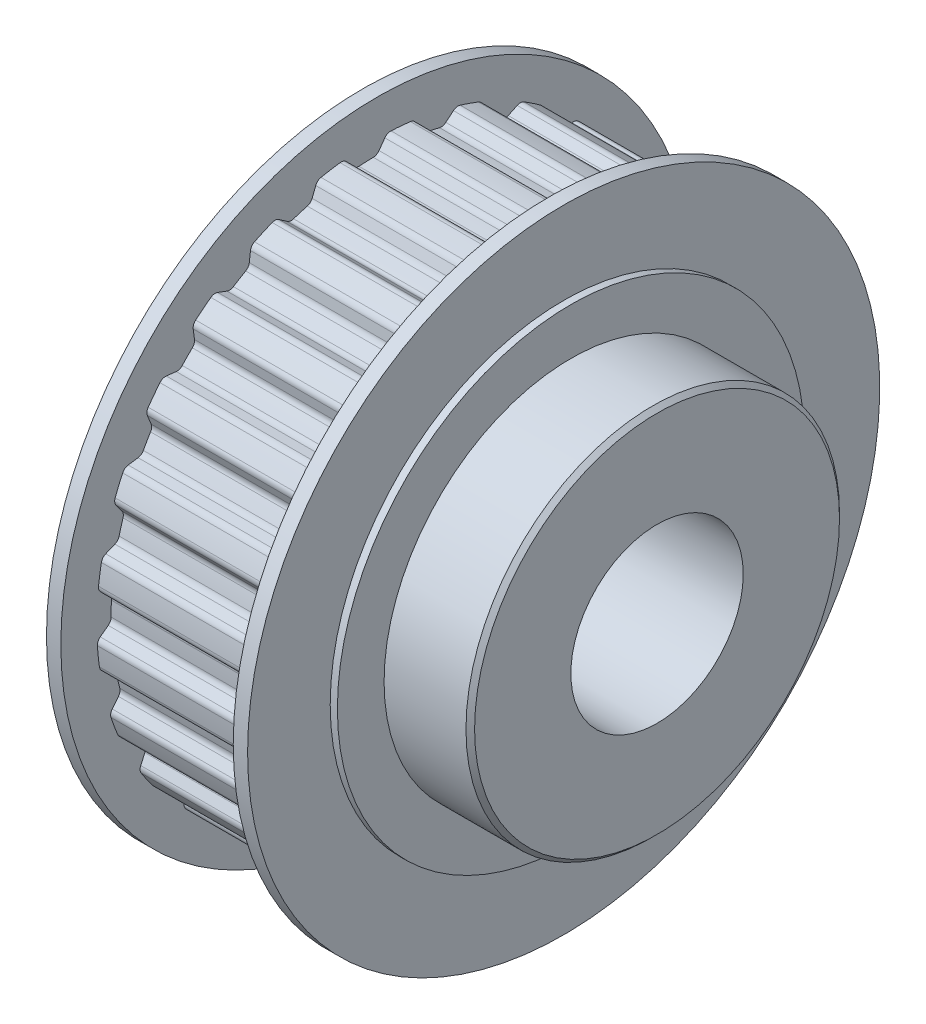
from build123d import *

# Parameters (mm, degrees)
CUT_EXTRUDE1_START = -12
CUT_EXTRUDE1_DEPTH = 12
FILLET1_R          = 0.5
SKETCH3_R          = 6
CUT_EXTRUDE2_DEPTH = 38.536648758
CHAMFER1_SIZE      = 0.3


with BuildPart() as part:
    # Sketch1 → Revolve1 (revolve)
    with BuildSketch(Plane.XY, mode=Mode.PRIVATE) as revolve1_sk:
        Polygon((0, 0), (0, 16.25), (0.5, 16.25), (0.5, 22), (1.5, 22), (1.5, 19.5), (13.5, 19.5), (13.5, 22), (14.5, 22), (14.5, 16.25), (15, 16.25), (15, 13), (21, 13), (21, 0), align=None)
    revolve(revolve1_sk.sketch.rotate(Axis((0, 0, 0), (1, 0, 0)), 90), axis=Axis((0, 0, 0), (1, 0, 0)))

    # Sketch2 → Cut-Extrude1 (cut)
    with BuildSketch(Plane.ZY.offset(-1.5).offset(CUT_EXTRUDE1_START)):
        with BuildLine():
            Line((2.288843908, 19.365205746), (1.5, 18.439088915))
            ThreePointArc((1.5, 18.439088915), (0.750618105, 18.484765956), (0, 18.5))
            Line((0, 18.5), (-0.711156092, 19.487027916))
            ThreePointArc((-0.711156092, 19.487027916), (0.791192057, 19.483942494), (2.288843908, 19.365205746))
        make_face()
        with BuildLine():
            Line((4.600762913, 17.918788481), (4.157412958, 19.051664429))
            ThreePointArc((4.157412958, 19.051664429), (5.611794764, 18.675057149), (7.032866499, 18.187599864))
            Line((7.032866499, 18.187599864), (6.038489683, 17.486756198))
            ThreePointArc((6.038489683, 17.486756198), (5.324010417, 17.717361911), (4.600762913, 17.918788481))
        make_face()
        with BuildLine():
            Line((8.912442971, 16.211673581), (8.764756462, 17.419214798))
            ThreePointArc((8.764756462, 17.419214798), (10.079787767, 16.692749281), (11.334988224, 15.867200193))
            Line((11.334988224, 15.867200193), (10.197558852, 15.435666279))
            ThreePointArc((10.197558852, 15.435666279), (9.562875574, 15.836710856), (8.912442971, 16.211673581))
        make_face()
        with BuildLine():
            Line((12.66412146, 13.485919607), (12.821378083, 14.692251838))
            ThreePointArc((12.821378083, 14.692251838), (13.914430635, 13.661574584), (14.924890951, 12.549805979))
            Line((14.924890951, 12.549805979), (13.715877894, 12.414696678))
            ThreePointArc((13.715877894, 12.414696678), (13.200870089, 12.960981016), (12.66412146, 13.485919607))
        make_face()
        with BuildLine():
            Line((15.620066622, 9.912795707), (16.072385365, 11.04212066))
            ThreePointArc((16.072385365, 11.04212066), (16.874778651, 9.771992912), (17.577007889, 8.4438613))
            Line((17.577007889, 8.4438613), (16.372377884, 8.613666027))
            ThreePointArc((16.372377884, 8.613666027), (16.009405387, 9.270865071), (15.620066622, 9.912795707))
        make_face()
        with BuildLine():
            Line((17.594545551, 5.716814396), (18.313505565, 6.698172432))
            ThreePointArc((18.313505565, 6.698172432), (18.774822264, 5.268400987), (19.124696779, 3.807357762))
            Line((19.124696779, 3.807357762), (18.000141158, 4.271407061))
            ThreePointArc((18.000141158, 4.271407061), (17.812010866, 4.998226577), (17.594545551, 5.716814396))
        make_face()
        with BuildLine():
            Line((18.463494476, 1.161624611), (19.403920858, 1.933353395))
            ThreePointArc((19.403920858, 1.933353395), (19.495174745, 0.433776052), (19.470710634, -1.068376068))
            Line((19.470710634, -1.068376068), (18.496889364, -0.33924012))
            ThreePointArc((18.496889364, -0.33924012), (18.495422194, 0.411531126), (18.463494476, 1.161624611))
        make_face()
        with BuildLine():
            Line((18.172314138, -3.46655432), (19.27511644, -2.952945346))
            ThreePointArc((19.27511644, -2.952945346), (18.990573699, -4.428104628), (18.593308131, -5.876979899))
            Line((18.593308131, -5.876979899), (17.831409984, -4.928571597))
            ThreePointArc((17.831409984, -4.928571597), (18.016698124, -4.20102234), (18.172314138, -3.46655432))
        make_face()
        with BuildLine():
            Line((16.739300471, -7.876916894), (17.935185568, -7.65369967))
            ThreePointArc((17.935185568, -7.65369967), (17.292725064, -9.011751209), (16.547619698, -10.31631147))
            Line((16.547619698, -10.31631147), (16.045517535, -9.208222794))
            ThreePointArc((16.045517535, -9.208222794), (16.405918651, -8.549610121), (16.739300471, -7.876916894))
        make_face()
        with BuildLine():
            Line((14.254494991, -11.79234381), (15.468321026, -11.873543896))
            ThreePointArc((15.468321026, -11.873543896), (14.508310916, -13.029156318), (13.46218346, -14.10743125))
            Line((13.46218346, -14.10743125), (13.251426209, -12.909287487))
            ThreePointArc((13.251426209, -12.909287487), (13.764294971, -12.360994456), (14.254494991, -11.79234381))
        make_face()
        with BuildLine():
            Line((10.874027167, -14.966814396), (12.029524985, -15.347329691))
            ThreePointArc((12.029524985, -15.347329691), (10.812286235, -16.227891618), (9.530868726, -17.012129241))
            Line((9.530868726, -17.012129241), (9.624699038, -15.799214171))
            ThreePointArc((9.624699038, -15.799214171), (10.257810018, -15.395692048), (10.874027167, -14.966814396))
        make_face()
        with BuildLine():
            Line((6.810304225, -17.200864989), (7.834869647, -17.856786318))
            ThreePointArc((7.834869647, -17.856786318), (6.436885845, -18.406968806), (5.000694457, -18.847892586))
            Line((5.000694457, -18.847892586), (5.39321663, -17.696418123))
            ThreePointArc((5.39321663, -17.696418123), (6.106789135, -17.463021688), (6.810304225, -17.200864989))
        make_face()
        with BuildLine():
            Line((2.318664821, -18.354121974), (3.147920635, -19.244235388))
            ThreePointArc((3.147920635, -19.244235388), (1.657032244, -19.429468447), (0.156308165, -19.499373522))
            Line((0.156308165, -19.499373522), (0.822858586, -18.481691041))
            ThreePointArc((0.822858586, -18.481691041), (1.572056232, -18.43308545), (2.318664821, -18.354121974))
        make_face()
        with BuildLine():
            Line((-2.318664821, -18.354121974), (-1.736823807, -19.422498373))
            ThreePointArc((-1.736823807, -19.422498373), (-3.226938787, -19.231143129), (-4.697899545, -18.925637106))
            Line((-4.697899545, -18.925637106), (-3.79920269, -18.105691341))
            ThreePointArc((-3.79920269, -18.105691341), (-3.061454746, -18.244930661), (-2.318664821, -18.354121974))
        make_face()
        with BuildLine():
            Line((-6.810304225, -17.200864989), (-6.512437222, -18.380374355))
            ThreePointArc((-6.512437222, -18.380374355), (-7.908149386, -17.824454362), (-9.256920948, -17.162733307))
            Line((-9.256920948, -17.162733307), (-8.182546087, -16.592044465))
            ThreePointArc((-8.182546087, -16.592044465), (-7.502603263, -16.910379779), (-6.810304225, -17.200864989))
        make_face()
        with BuildLine():
            Line((-10.874027167, -14.966814396), (-10.878850256, -16.183343817))
            ThreePointArc((-10.878850256, -16.183343817), (-12.092461875, -15.297789573), (-13.234295964, -14.321431854))
            Line((-13.234295964, -14.321431854), (-12.051750021, -14.035858414))
            ThreePointArc((-12.051750021, -14.035858414), (-11.472335625, -14.513287543), (-10.874027167, -14.966814396))
        make_face()
        with BuildLine():
            Line((-14.254494991, -11.79234381), (-14.561705118, -12.96945427))
            ThreePointArc((-14.561705118, -12.96945427), (-15.516960511, -11.809908403), (-16.380111492, -10.580262167))
            Line((-16.380111492, -10.580262167), (-15.163698178, -10.597747759))
            ThreePointArc((-15.163698178, -10.597747759), (-14.721218946, -11.204272075), (-14.254494991, -11.79234381))
        make_face()
        with BuildLine():
            Line((-16.739300471, -7.876916894), (-17.329594494, -8.940646212))
            ThreePointArc((-17.329594494, -8.940646212), (-17.966471451, -7.579967255), (-18.496704373, -6.174295697))
            Line((-18.496704373, -6.174295697), (-17.32285541, -6.493741636))
            ThreePointArc((-17.32285541, -6.493741636), (-17.045113941, -7.191250986), (-16.739300471, -7.876916894))
        make_face()
        with BuildLine():
            Line((-18.172314138, -3.46655432), (-19.008601713, -4.350064471))
            ThreePointArc((-19.008601713, -4.350064471), (-19.287082914, -2.873748887), (-19.451081292, -1.38037552))
            Line((-19.451081292, -1.38037552), (-18.393553928, -1.981709844))
            ThreePointArc((-18.393553928, -1.981709844), (-18.298001739, -2.72637715), (-18.172314138, -3.46655432))
        make_face()
        with BuildLine():
            Line((-18.463494476, 1.161624611), (-19.493228579, 0.513847819))
            ThreePointArc((-19.493228579, 0.513847819), (-19.395816024, 2.013037692), (-19.183275237, 3.500278727))
            Line((-19.183275237, 3.500278727), (-18.308517805, 2.654840065))
            ThreePointArc((-18.308517805, 2.654840065), (-18.401158792, 1.90980499), (-18.463494476, 1.161624611))
        make_face()
        with BuildLine():
            Line((-17.594545551, 5.716814396), (-18.753024201, 5.34547316))
            ThreePointArc((-18.753024201, 5.34547316), (-18.285838681, 6.77333771), (-17.710113449, 8.160997588))
            Line((-17.710113449, 8.160997588), (-17.073090175, 7.12457661))
            ThreePointArc((-17.073090175, 7.12457661), (-17.348103364, 6.425987058), (-17.594545551, 5.716814396))
        make_face()
        with BuildLine():
            Line((-15.620066622, 9.912795707), (-16.834498344, 9.841222764))
            ThreePointArc((-16.834498344, 9.841222764), (-16.026894843, 11.108044009), (-15.124160099, 12.308930957))
            Line((-15.124160099, 12.308930957), (-14.764897499, 11.146649804))
            ThreePointArc((-14.764897499, 11.146649804), (-15.2050028, 10.538400726), (-15.620066622, 9.912795707))
        make_face()
        with BuildLine():
            Line((-12.66412146, 13.485919607), (-13.858199044, 13.718612148))
            ThreePointArc((-13.858199044, 13.718612148), (-12.760922259, 14.74479105), (-11.587900147, 15.683448925))
            Line((-11.587900147, 15.683448925), (-11.528972011, 14.468337996))
            ThreePointArc((-11.528972011, 14.468337996), (-12.106515989, 13.988647919), (-12.66412146, 13.485919607))
        make_face()
        with BuildLine():
            Line((-8.912442971, 16.211673581), (-10.01113813, 16.734010677))
            ThreePointArc((-10.01113813, 16.734010677), (-8.693133998, 17.455068642), (-7.323529812, 18.072518117))
            Line((-7.323529812, 18.072518117), (-7.568638812, 16.880927301))
            ThreePointArc((-7.568638812, 16.880927301), (-8.247332254, 16.559936917), (-8.912442971, 16.211673581))
        make_face()
        with BuildLine():
            Line((-4.600762913, 17.918788481), (-5.53504059, 18.697949772))
            ThreePointArc((-5.53504059, 18.697949772), (-4.079124157, 19.068580076), (-2.598995164, 19.32602453))
            Line((-2.598995164, 19.32602453), (-3.1327402, 18.23282586))
            ThreePointArc((-3.1327402, 18.23282586), (-3.869938303, 18.090704175), (-4.600762913, 17.918788481))
        make_face()
    extrude(amount=CUT_EXTRUDE1_DEPTH, mode=Mode.SUBTRACT)

    # Fillet1
    fillet1_edges = [part.edges().sort_by_distance(p)[0] for p in [
        (7.5, -3.46655432, 18.172314138),
        (7.5, -4.928571597, 17.831409984),
        (7.5, -5.876979899, 18.593308131),
        (7.5, -2.952945346, 19.27511644),
        (7.5, -7.876916894, 16.739300471),
        (7.5, -9.208222794, 16.045517535),
        (7.5, -10.31631147, 16.547619698),
        (7.5, -7.65369967, 17.935185568),
        (7.5, -11.79234381, 14.254494991),
        (7.5, -12.909287487, 13.251426209),
        (7.5, -14.10743125, 13.46218346),
        (7.5, -11.873543896, 15.468321026),
        (7.5, -14.966814396, 10.874027167),
        (7.5, -15.799214171, 9.624699038),
        (7.5, -17.012129241, 9.530868726),
        (7.5, -15.347329691, 12.029524985),
        (7.5, -17.200864989, 6.810304225),
        (7.5, -17.696418123, 5.39321663),
        (7.5, -18.847892586, 5.000694457),
        (7.5, -17.856786318, 7.834869647),
        (7.5, -18.354121974, 2.318664821),
        (7.5, -18.481691041, 0.822858586),
        (7.5, -19.499373522, 0.156308165),
        (7.5, -19.244235388, 3.147920635),
        (7.5, -18.354121974, -2.318664821),
        (7.5, -18.105691341, -3.79920269),
        (7.5, -18.925637106, -4.697899545),
        (7.5, -19.422498373, -1.736823807),
        (7.5, -17.200864989, -6.810304225),
        (7.5, -16.592044465, -8.182546087),
        (7.5, -17.162733307, -9.256920948),
        (7.5, -18.380374355, -6.512437222),
        (7.5, -14.966814396, -10.874027167),
        (7.5, -14.035858414, -12.051750021),
        (7.5, -14.321431854, -13.234295964),
        (7.5, -16.183343817, -10.878850256),
        (7.5, -11.79234381, -14.254494991),
        (7.5, -10.597747759, -15.163698178),
        (7.5, -10.580262167, -16.380111492),
        (7.5, -12.96945427, -14.561705118),
        (7.5, -7.876916894, -16.739300471),
        (7.5, -6.493741636, -17.32285541),
        (7.5, -6.174295697, -18.496704373),
        (7.5, -8.940646212, -17.329594494),
        (7.5, -3.46655432, -18.172314138),
        (7.5, -1.981709844, -18.393553928),
        (7.5, -1.38037552, -19.451081292),
        (7.5, -4.350064471, -19.008601713),
        (7.5, 1.161624611, -18.463494476),
        (7.5, 2.654840065, -18.308517805),
        (7.5, 3.500278727, -19.183275237),
        (7.5, 0.513847819, -19.493228579),
        (7.5, 5.716814396, -17.594545551),
        (7.5, 7.12457661, -17.073090175),
        (7.5, 8.160997588, -17.710113449),
        (7.5, 5.34547316, -18.753024201),
        (7.5, 9.912795707, -15.620066622),
        (7.5, 11.146649804, -14.764897499),
        (7.5, 12.308930957, -15.124160099),
        (7.5, 9.841222764, -16.834498344),
        (7.5, 13.485919607, -12.66412146),
        (7.5, 14.468337996, -11.528972011),
        (7.5, 15.683448925, -11.587900147),
        (7.5, 13.718612148, -13.858199044),
        (7.5, 16.211673581, -8.912442971),
        (7.5, 16.880927301, -7.568638812),
        (7.5, 18.072518117, -7.323529812),
        (7.5, 16.734010677, -10.01113813),
        (7.5, 17.918788481, -4.600762913),
        (7.5, 18.23282586, -3.1327402),
        (7.5, 19.32602453, -2.598995164),
        (7.5, 18.697949772, -5.53504059),
        (7.5, 17.918788481, 4.600762913),
        (7.5, 17.486756198, 6.038489683),
        (7.5, 18.187599864, 7.032866499),
        (7.5, 19.051664429, 4.157412958),
        (7.5, 18.5, 0),
        (7.5, 18.439088915, 1.5),
        (7.5, 19.365205746, 2.288843908),
        (7.5, 19.487027916, -0.711156092),
        (7.5, 16.211673581, 8.912442971),
        (7.5, 15.435666279, 10.197558852),
        (7.5, 15.867200193, 11.334988224),
        (7.5, 17.419214798, 8.764756462),
        (7.5, 13.485919607, 12.66412146),
        (7.5, 12.414696678, 13.715877894),
        (7.5, 12.549805979, 14.924890951),
        (7.5, 14.692251838, 12.821378083),
        (7.5, 9.912795707, 15.620066622),
        (7.5, 8.613666027, 16.372377884),
        (7.5, 8.4438613, 17.577007889),
        (7.5, 11.04212066, 16.072385365),
        (7.5, 5.716814396, 17.594545551),
        (7.5, 4.271407061, 18.000141158),
        (7.5, 3.807357762, 19.124696779),
        (7.5, 6.698172432, 18.313505565),
        (7.5, 1.161624611, 18.463494476),
        (7.5, -0.33924012, 18.496889364),
        (7.5, -1.068376068, 19.470710634),
        (7.5, 1.933353395, 19.403920858),
    ]]
    fillet(fillet1_edges, radius=FILLET1_R)

    # Sketch3 → Cut-Extrude2 (cut, through all)
    with BuildSketch(Plane(origin=(21, 0, 0), x_dir=(0, 0, -1), z_dir=(1, 0, 0))):
        Circle(SKETCH3_R)
    extrude(amount=-CUT_EXTRUDE2_DEPTH, mode=Mode.SUBTRACT)

    # Chamfer1
    chamfer1_edges = [part.edges().sort_by_distance(p)[0] for p in [
        (21, 0, -13),
    ]]
    chamfer(chamfer1_edges, length=CHAMFER1_SIZE)


solid = part.part
